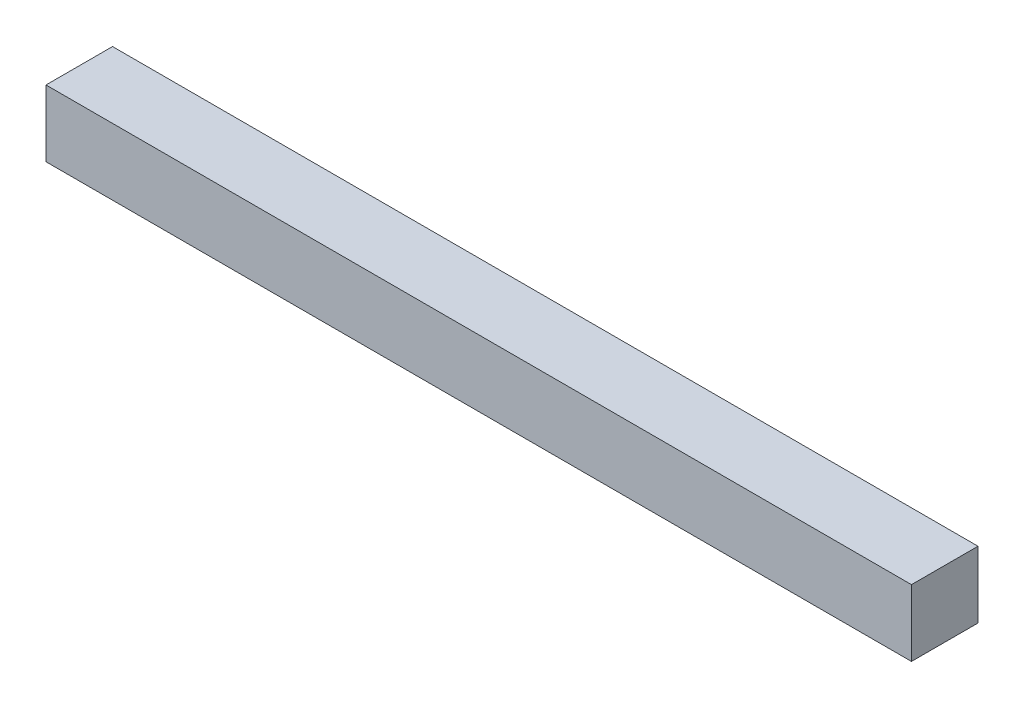
from build123d import *

# Parameters (mm, degrees)
SKETCH_1_W        = 1600
SKETCH_1_H        = 123
EXTRUDE_304_DEPTH = 123


with BuildPart() as part:
    # 草图1 → Extrude 304 (new body)
    with BuildSketch(Plane.XY):
        with Locations((800, 61.5)):
            Rectangle(SKETCH_1_W, SKETCH_1_H)
    extrude(amount=EXTRUDE_304_DEPTH)


solid = part.part
